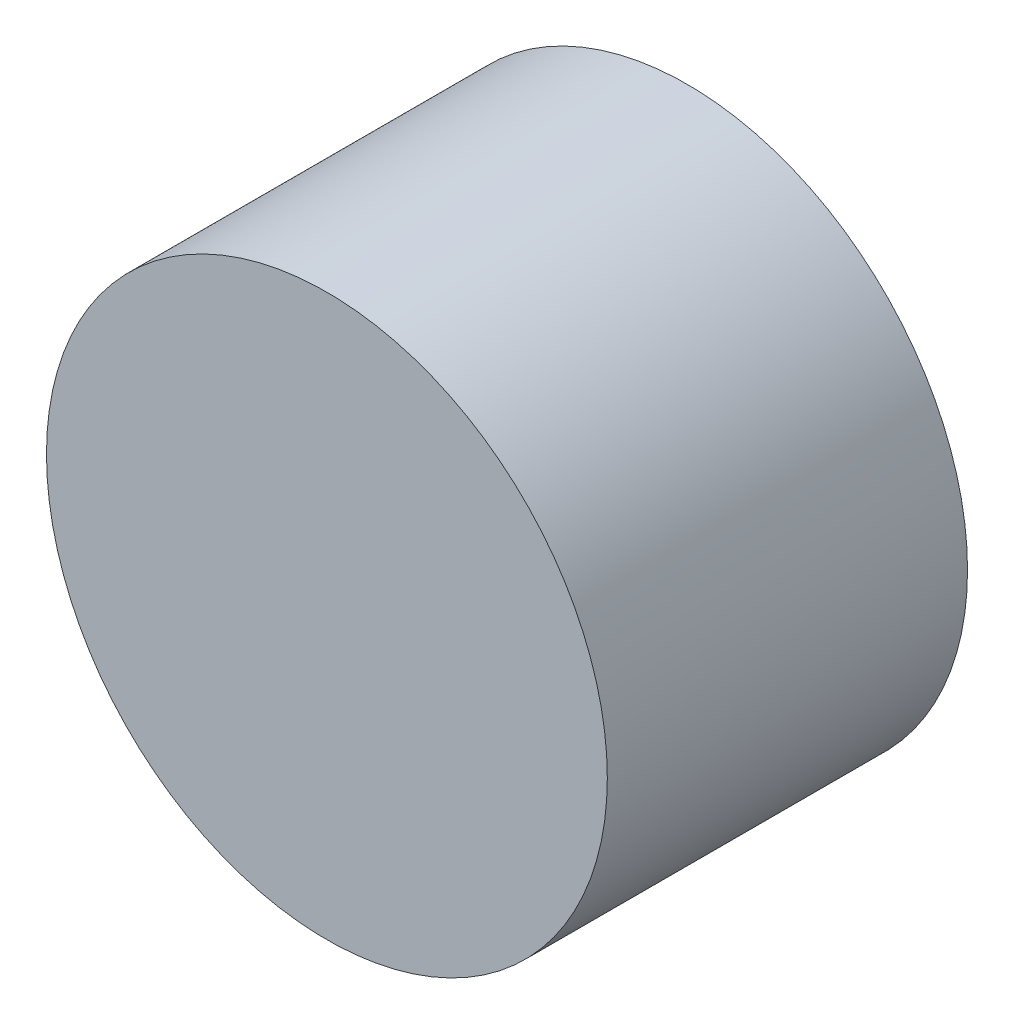
from build123d import *

# Parameters (mm, degrees)
SKETCH1_R           = 51.41416701
BOSS_EXTRUDE1_DEPTH = 66.04


with BuildPart() as part:
    # Sketch1 → Boss-Extrude1 (new body)
    with BuildSketch(Plane.XY):
        Circle(SKETCH1_R)
    extrude(amount=BOSS_EXTRUDE1_DEPTH)


solid = part.part
